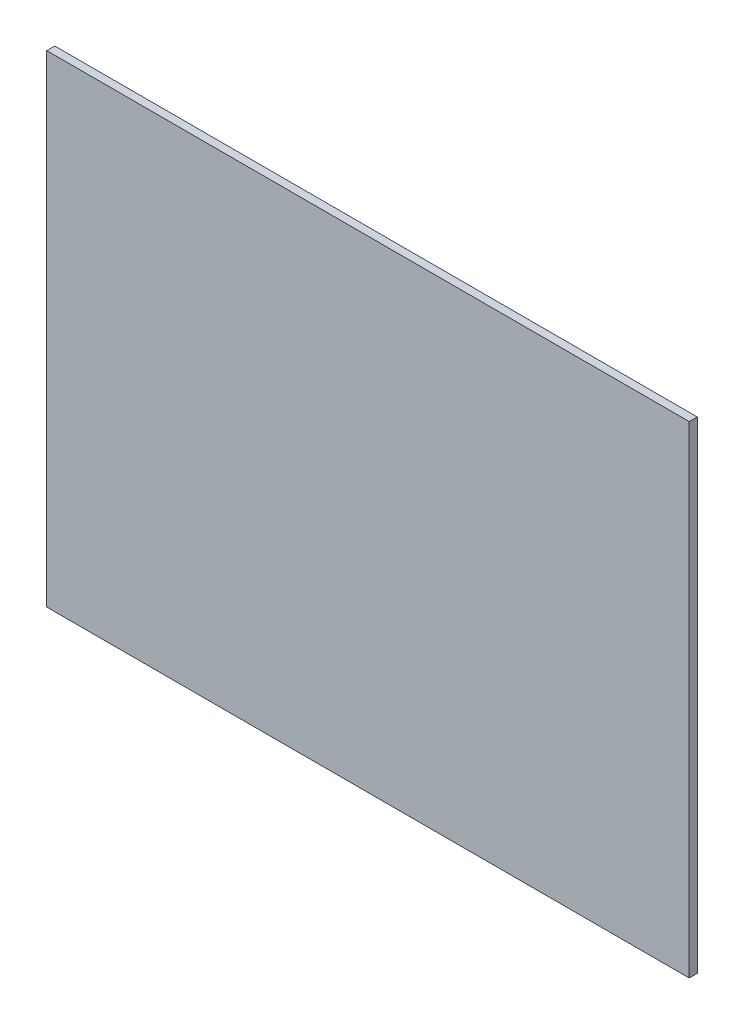
from build123d import *

# Parameters (mm, degrees)
SKETCH1_W           = 60
SKETCH1_H           = 80
BOSS_EXTRUDE1_DEPTH = 1
SCALE1_SCALE        = 0.7


with BuildPart() as part:
    # Sketch1 → Boss-Extrude1 (new body)
    with BuildSketch(Plane(origin=(0, 0, 0), x_dir=(0, 1, 0), z_dir=(0, 0, 1))):
        Rectangle(SKETCH1_W, SKETCH1_H)
    extrude(amount=-BOSS_EXTRUDE1_DEPTH)


with BuildPart() as part_1:
    # Scale1: scaled about (0, 0, -0.5)
    add(part.part.scale(SCALE1_SCALE).moved(Location((0, 0, -0.15))))


solid = part_1.part
